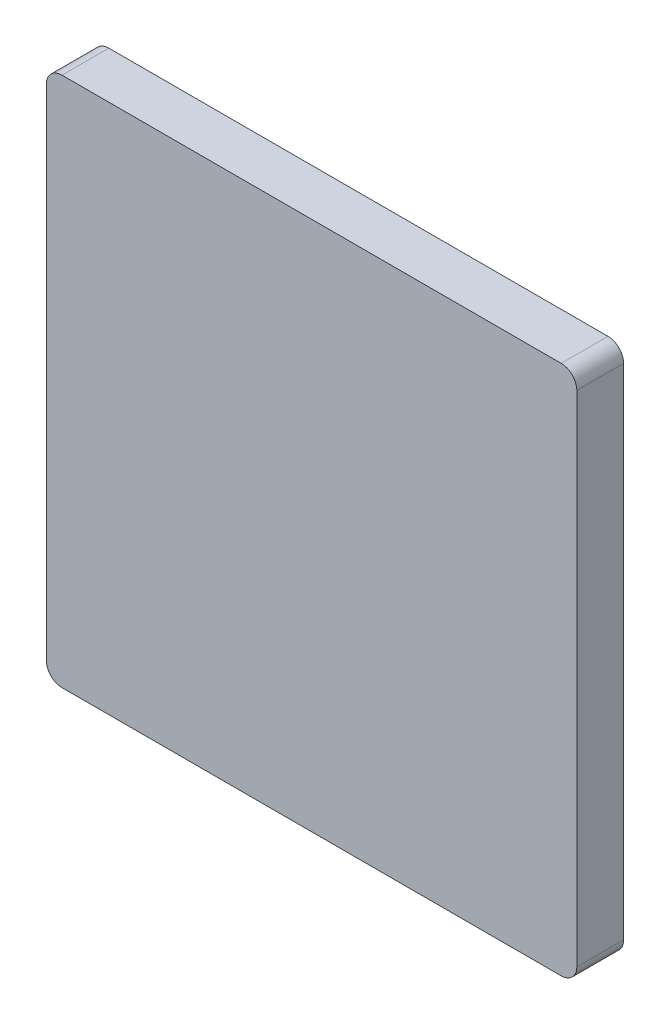
from build123d import *

# Parameters (mm, degrees)
SKETCH_1_W      = 6.8
SKETCH_1_H      = 6.8
EXTRUDE_1_DEPTH = 0.6
FILLET_1_R      = 0.2


with BuildPart() as part:
    # 草图1 → 凸台-拉伸1 (new body)
    with BuildSketch(Plane.XY):
        with Locations((3.4, 3.4)):
            Rectangle(SKETCH_1_W, SKETCH_1_H)
    extrude(amount=EXTRUDE_1_DEPTH)

    # 圆角1
    fillet_1_edges = [part.edges().sort_by_distance(p)[0] for p in [
        (0, 6.8, 0.3),
        (6.8, 6.8, 0.3),
        (6.8, 0, 0.3),
        (0, 0, 0.3),
    ]]
    fillet(fillet_1_edges, radius=FILLET_1_R)


solid = part.part
